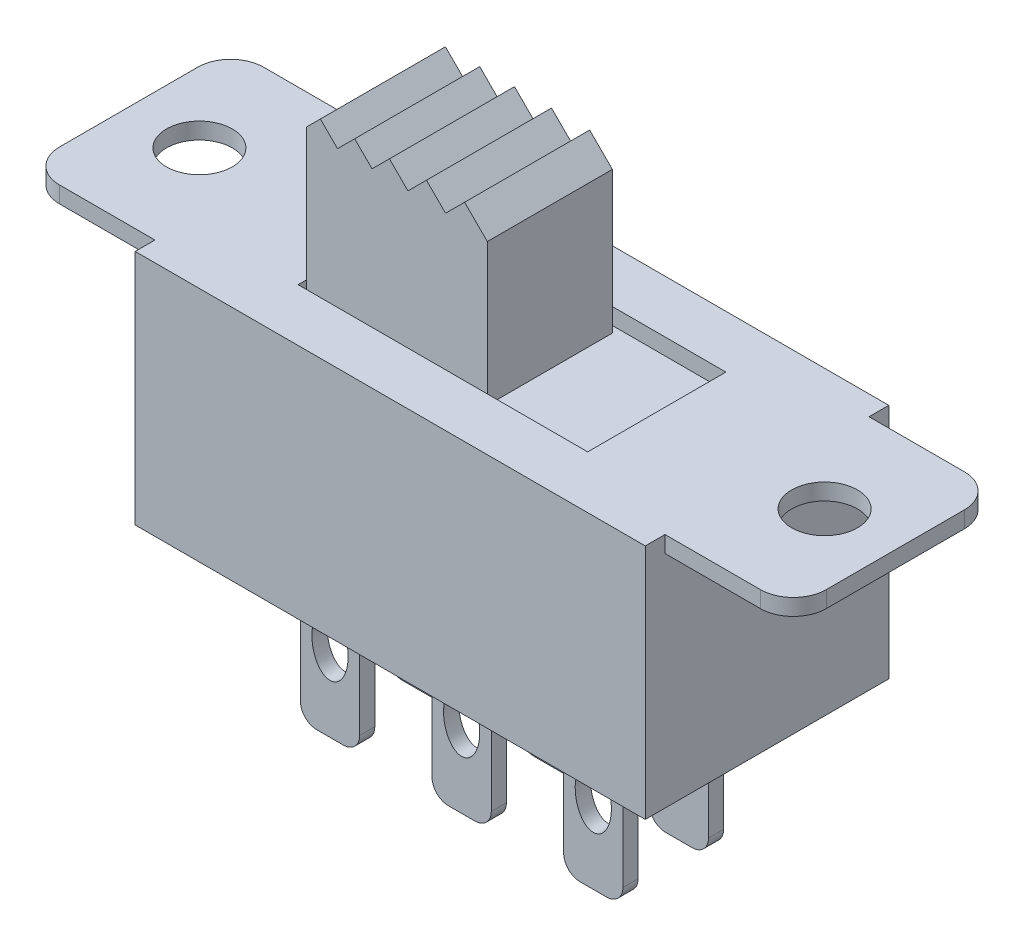
from build123d import *

# Parameters (mm, degrees)
CROQUIS1_R              = 1
SALIENTE_EXTRUIR1_DEPTH = 0.5
CROQUIS2_W              = 15.5
CROQUIS2_H              = 7.4
SALIENTE_EXTRUIR2_DEPTH = 6.7
CROQUIS3_W              = 1.8
CROQUIS3_H              = 0.46
SALIENTE_EXTRUIR3_DEPTH = 4.8
CROQUIS4_W              = 8.8
CROQUIS4_H              = 4.2
CORTAR_EXTRUIR1_DEPTH   = 0.5
CROQUIS5_W              = 5.5
CROQUIS5_H              = 3.8
SALIENTE_EXTRUIR4_DEPTH = 5
CORTAR_EXTRUIR2_REACH   = 19.185
CROQUIS6_RX             = 0.9
CROQUIS6_RY             = 0.55
REDONDEO2_R             = 0.5
CORTAR_EXTRUIR3_REACH   = 19.301


with BuildPart() as part:
    # Croquis1 → Saliente-Extruir1 (new body)
    with BuildSketch(Plane(origin=(0, 0, 0), x_dir=(1, 0, 0), z_dir=(0, 1, 0))):
        with BuildLine():
            Line((10.65, 3.1), (7.75, 3.1))
            Line((7.75, 3.1), (7.75, 3.7))
            Line((7.75, 3.7), (-7.75, 3.7))
            Line((-7.75, 3.7), (-7.75, 3.1))
            Line((-7.75, 3.1), (-10.65, 3.1))
            ThreePointArc((-10.65, 3.1), (-11.357106781, 2.807106781), (-11.65, 2.1))
            Line((-11.65, 2.1), (-11.65, -2.1))
            ThreePointArc((-11.65, -2.1), (-11.357106781, -2.807106781), (-10.65, -3.1))
            Line((-10.65, -3.1), (-7.75, -3.1))
            Line((-7.75, -3.1), (-7.75, -3.7))
            Line((-7.75, -3.7), (7.75, -3.7))
            Line((7.75, -3.7), (7.75, -3.1))
            Line((7.75, -3.1), (10.65, -3.1))
            ThreePointArc((10.65, -3.1), (11.357106781, -2.807106781), (11.65, -2.1))
            Line((11.65, -2.1), (11.65, 2.1))
            ThreePointArc((11.65, 2.1), (11.357106781, 2.807106781), (10.65, 3.1))
        make_face()
        with Locations(Location((9.5, 0, 0), (0, 0, 270))):
            Circle(CROQUIS1_R, mode=Mode.SUBTRACT)
        with Locations(Location((-9.5, 0, 0), (0, 0, 270))):
            Circle(CROQUIS1_R, mode=Mode.SUBTRACT)
    extrude(amount=SALIENTE_EXTRUIR1_DEPTH)

    # Croquis2 → Saliente-Extruir2 (add)
    with BuildSketch(Plane.XZ):
        Rectangle(CROQUIS2_W, CROQUIS2_H)
    extrude(amount=SALIENTE_EXTRUIR2_DEPTH)

    # Croquis3 → Saliente-Extruir3 (add)
    with BuildSketch(Plane.XZ.offset(6.7)):
        with Locations((0, -1.3)):
            Rectangle(CROQUIS3_W, CROQUIS3_H)
        with Locations((-4, -1.3)):
            Rectangle(CROQUIS3_W, CROQUIS3_H)
        with Locations((4, -1.3)):
            Rectangle(CROQUIS3_W, CROQUIS3_H)
        with Locations((4, 1.3)):
            Rectangle(CROQUIS3_W, CROQUIS3_H)
        with Locations((-4, 1.3)):
            Rectangle(CROQUIS3_W, CROQUIS3_H)
        with Locations((0, 1.3)):
            Rectangle(CROQUIS3_W, CROQUIS3_H)
    extrude(amount=SALIENTE_EXTRUIR3_DEPTH)

    # Croquis4 → Cortar-Extruir1 (cut)
    with BuildSketch(Plane(origin=(0, 0.5, 0), x_dir=(1, 0, 0), z_dir=(0, 1, 0))):
        Rectangle(CROQUIS4_W, CROQUIS4_H)
    extrude(amount=-CORTAR_EXTRUIR1_DEPTH, mode=Mode.SUBTRACT)

    # Croquis5 → Saliente-Extruir4 (add)
    with BuildSketch(Plane(origin=(0, 0, 0), x_dir=(1, 0, 0), z_dir=(0, 1, 0))):
        with Locations((-1.6, 0)):
            Rectangle(CROQUIS5_W, CROQUIS5_H)
    extrude(amount=SALIENTE_EXTRUIR4_DEPTH)

    # Cortar-Extruir2: up to this face of the body (flat: up to its plane)
    cortar_extruir2_end = Plane(part.part.faces().sort_by_distance((-4, -9.1, -1.53))[0])
    # Croquis6 → Cortar-Extruir2 (cut, up to the picked face)
    with BuildSketch(Plane.XY.offset(1.53), mode=Mode.PRIVATE) as cortar_extruir2_sk1:
        with Locations(Location((-4, -9.1), (0, 0, -90))):
            Ellipse(CROQUIS6_RX, CROQUIS6_RY)
    cortar_extruir2_tool1 = split(extrude(cortar_extruir2_sk1.sketch, amount=-CORTAR_EXTRUIR2_REACH, mode=Mode.PRIVATE), bisect_by=cortar_extruir2_end, keep=Keep.BOTH, mode=Mode.PRIVATE)
    # Croquis6 → Cortar-Extruir2 (cut, up to the picked face)
    with BuildSketch(Plane.XY.offset(1.53), mode=Mode.PRIVATE) as cortar_extruir2_sk2:
        with Locations(Location((0, -9.1), (0, 0, 90))):
            Ellipse(CROQUIS6_RX, CROQUIS6_RY)
    cortar_extruir2_tool2 = split(extrude(cortar_extruir2_sk2.sketch, amount=-CORTAR_EXTRUIR2_REACH, mode=Mode.PRIVATE), bisect_by=cortar_extruir2_end, keep=Keep.BOTH, mode=Mode.PRIVATE)
    # Croquis6 → Cortar-Extruir2 (cut, up to the picked face)
    with BuildSketch(Plane.XY.offset(1.53), mode=Mode.PRIVATE) as cortar_extruir2_sk3:
        with Locations(Location((4, -9.1), (0, 0, -90))):
            Ellipse(CROQUIS6_RX, CROQUIS6_RY)
    cortar_extruir2_tool3 = split(extrude(cortar_extruir2_sk3.sketch, amount=-CORTAR_EXTRUIR2_REACH, mode=Mode.PRIVATE), bisect_by=cortar_extruir2_end, keep=Keep.BOTH, mode=Mode.PRIVATE)
    add(cortar_extruir2_tool1.solids().sort_by(Axis((-4, -9.1, 1.53), (0, 0, -1)))[0], mode=Mode.SUBTRACT)
    add(cortar_extruir2_tool2.solids().sort_by(Axis((0, -9.1, 1.53), (0, 0, -1)))[0], mode=Mode.SUBTRACT)
    add(cortar_extruir2_tool3.solids().sort_by(Axis((4, -9.1, 1.53), (0, 0, -1)))[0], mode=Mode.SUBTRACT)

    # Redondeo2
    redondeo2_edges = [part.edges().sort_by_distance(p)[0] for p in [
        (0.9, -11.5, 1.3),
        (-0.9, -11.5, 1.3),
        (4.9, -11.5, 1.3),
        (3.1, -11.5, 1.3),
        (-3.1, -11.5, 1.3),
        (-4.9, -11.5, 1.3),
        (-0.9, -11.5, -1.3),
        (0.9, -11.5, -1.3),
        (-4.9, -11.5, -1.3),
        (-3.1, -11.5, -1.3),
        (3.1, -11.5, -1.3),
        (4.9, -11.5, -1.3),
    ]]
    fillet(redondeo2_edges, radius=REDONDEO2_R)

    # Croquis7 → Cortar-Extruir3 (cut, up to next)
    with BuildSketch(Plane.XY.offset(1.9), mode=Mode.PRIVATE) as cortar_extruir3_sk1:
        Polygon((-3.923177813, 5), (-4.35, 5), (-4.35, 4.573177813), align=None)
    cortar_extruir3_tool1 = extrude(cortar_extruir3_sk1.sketch, amount=-CORTAR_EXTRUIR3_REACH, mode=Mode.PRIVATE) & part.part
    # Croquis7 → Cortar-Extruir3 (cut, up to next)
    with BuildSketch(Plane.XY.offset(1.9), mode=Mode.PRIVATE) as cortar_extruir3_sk2:
        Polygon((1.15, 5), (0.460006212, 5), (1.15, 4.310006212), align=None)
    cortar_extruir3_tool2 = extrude(cortar_extruir3_sk2.sketch, amount=-CORTAR_EXTRUIR3_REACH, mode=Mode.PRIVATE) & part.part
    # Croquis7 → Cortar-Extruir3 (cut, up to next)
    with BuildSketch(Plane.XY.offset(1.9), mode=Mode.PRIVATE) as cortar_extruir3_sk3:
        Polygon((0.460006212, 5), (-0.699513597, 5), (-0.119753693, 4.420240095), align=None)
    cortar_extruir3_tool3 = extrude(cortar_extruir3_sk3.sketch, amount=-CORTAR_EXTRUIR3_REACH, mode=Mode.PRIVATE) & part.part
    # Croquis7 → Cortar-Extruir3 (cut, up to next)
    with BuildSketch(Plane.XY.offset(1.9), mode=Mode.PRIVATE) as cortar_extruir3_sk4:
        Polygon((-0.699513597, 5), (-1.824858034, 5), (-1.262185815, 4.437327782), align=None)
    cortar_extruir3_tool4 = extrude(cortar_extruir3_sk4.sketch, amount=-CORTAR_EXTRUIR3_REACH, mode=Mode.PRIVATE) & part.part
    # Croquis7 → Cortar-Extruir3 (cut, up to next)
    with BuildSketch(Plane.XY.offset(1.9), mode=Mode.PRIVATE) as cortar_extruir3_sk5:
        Polygon((-1.824858034, 5), (-2.880534962, 5), (-2.352696498, 4.472161536), align=None)
    cortar_extruir3_tool5 = extrude(cortar_extruir3_sk5.sketch, amount=-CORTAR_EXTRUIR3_REACH, mode=Mode.PRIVATE) & part.part
    # Croquis7 → Cortar-Extruir3 (cut, up to next)
    with BuildSketch(Plane.XY.offset(1.9), mode=Mode.PRIVATE) as cortar_extruir3_sk6:
        Polygon((-2.880534962, 5), (-3.923177813, 5), (-3.401856388, 4.478678575), align=None)
    cortar_extruir3_tool6 = extrude(cortar_extruir3_sk6.sketch, amount=-CORTAR_EXTRUIR3_REACH, mode=Mode.PRIVATE) & part.part
    add(cortar_extruir3_tool1.solids().sort_by_distance((-4.207726, 4.857726, 1.9))[0], mode=Mode.SUBTRACT)
    add(cortar_extruir3_tool2.solids().sort_by_distance((0.920002, 4.770002, 1.9))[0], mode=Mode.SUBTRACT)
    add(cortar_extruir3_tool3.solids().sort_by_distance((-0.119754, 4.806747, 1.9))[0], mode=Mode.SUBTRACT)
    add(cortar_extruir3_tool4.solids().sort_by_distance((-1.262186, 4.812443, 1.9))[0], mode=Mode.SUBTRACT)
    add(cortar_extruir3_tool5.solids().sort_by_distance((-2.352696, 4.824054, 1.9))[0], mode=Mode.SUBTRACT)
    add(cortar_extruir3_tool6.solids().sort_by_distance((-3.401856, 4.826226, 1.9))[0], mode=Mode.SUBTRACT)


solid = part.part
